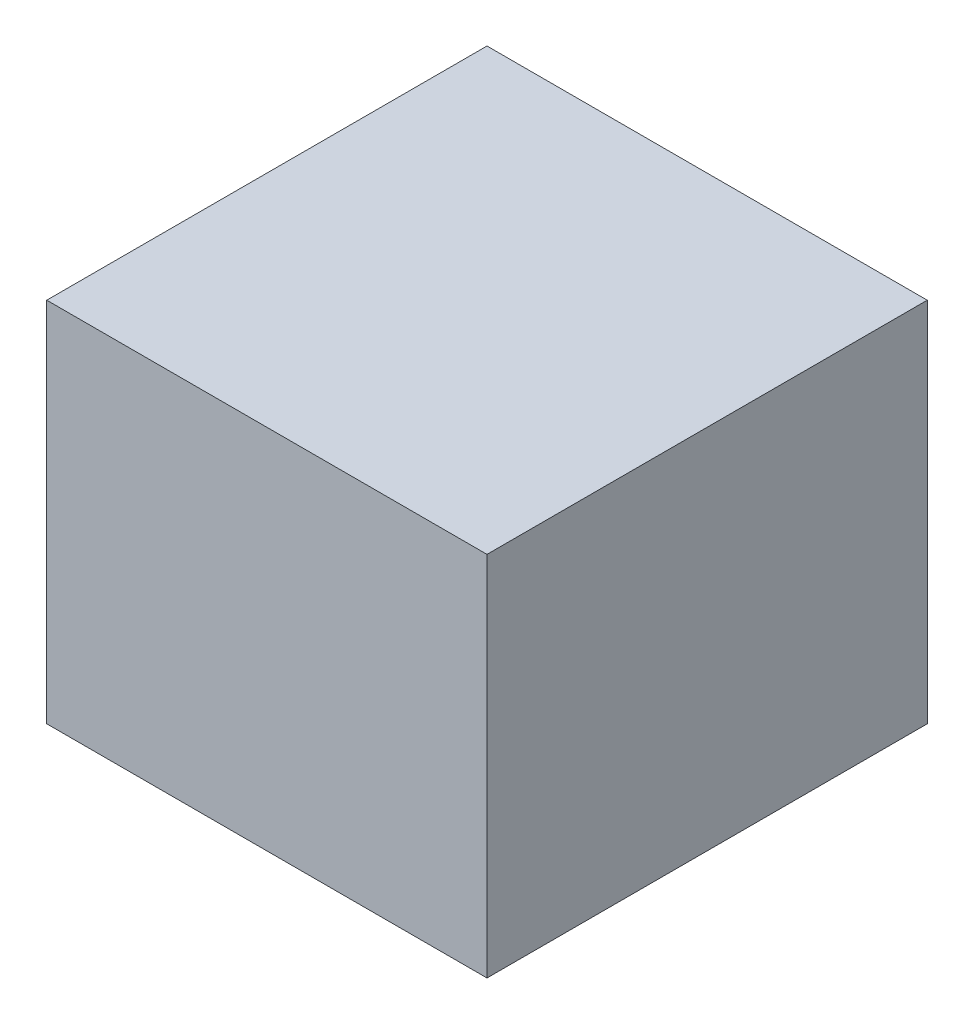
from build123d import *

# Parameters (mm, degrees)
SKETCH1_W           = 76.2
SKETCH1_H           = 63.5
BOSS_EXTRUDE1_DEPTH = 76.2


with BuildPart() as part:
    # Sketch1 → Boss-Extrude1 (new body)
    with BuildSketch(Plane.XY):
        with Locations((38.1, 31.75)):
            Rectangle(SKETCH1_W, SKETCH1_H)
    extrude(amount=BOSS_EXTRUDE1_DEPTH)


solid = part.part
